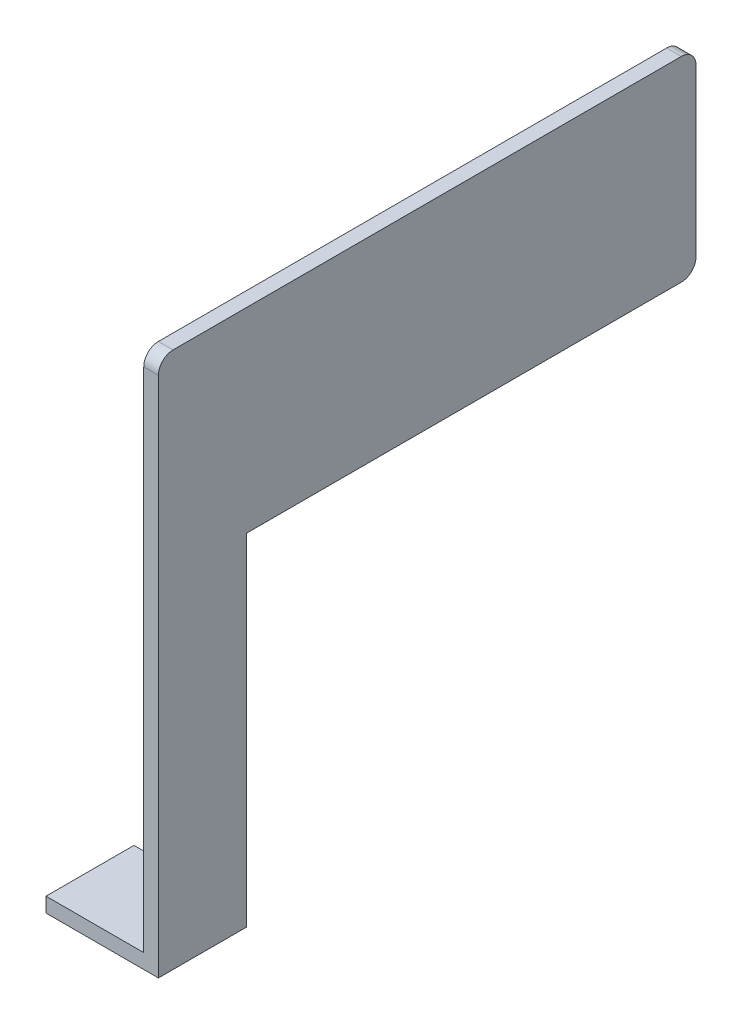
from build123d import *

# Parameters (mm, degrees)
EXTRUDE_1_DEPTH = 0.3
SKETCH_3_W      = 1.8
SKETCH_3_H      = 0.3
EXTRUDE_2_DEPTH = 2
FILLET_1_R      = 0.3


with BuildPart() as part:
    # 草图1 → 凸台-拉伸1 (new body)
    with BuildSketch(Plane(origin=(0, 0, 0), x_dir=(0, 0, -1), z_dir=(1, 0, 0))):
        Polygon((-5.5, -2), (-5.5, -1.5), (-5.5, -0.5), (-5.5, 0.5), (-5.5, 1.5), (-5.5, 2), (5.5, 2), (5.5, 1.5), (5.5, 0.5), (5.5, -0.5), (5.5, -1.5), (5.5, -2), (-3.7, -2), (-3.7, -8.98), (-5.5, -8.98), align=None)
    extrude(amount=EXTRUDE_1_DEPTH)

    # 草图3 → 凸台-拉伸2 (add)
    with BuildSketch(Plane.ZY):
        with Locations((4.6, -8.83)):
            Rectangle(SKETCH_3_W, SKETCH_3_H)
    extrude(amount=EXTRUDE_2_DEPTH)

    # 圆角1
    fillet_1_edges = [part.edges().sort_by_distance(p)[0] for p in [
        (0.15, -2, -5.5),
        (0.15, 2, 5.5),
        (0.15, 2, -5.5),
    ]]
    fillet(fillet_1_edges, radius=FILLET_1_R)


solid = part.part
